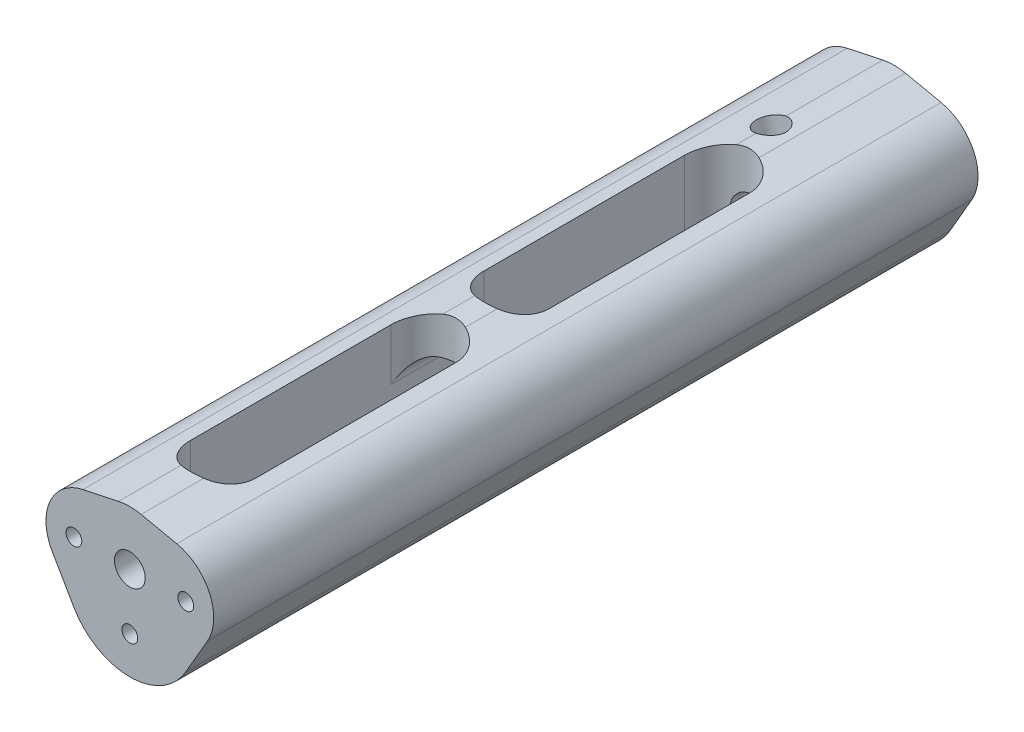
from build123d import *

# Parameters (mm, degrees)
BODYSKE_R       = 0.825
BODYSKE_R_2     = 0.425
BODY_DEPTH      = 41
HOLE_PROFILE_R  = 0.8
CUT1_DEPTH      = 0.825
CUT1_DEPTH_BACK = 42.54816492
CUT2_DEPTH      = 42.548164932
FILLET_2_R      = 1


with BuildPart() as part:
    # BodySke → Body (new body)
    with BuildSketch(Plane.XY):
        with BuildLine():
            Line((4.165063509, -1.25), (3, -3.267949192))
            ThreePointArc((3, -3.267949192), (0, -5), (-3, -3.267949192))
            Line((-3, -3.267949192), (-4.165063509, -1.25))
            ThreePointArc((-4.165063509, -1.25), (-4.283863644, 1.016841608), (-2.519779227, 2.445369002))
            Line((-2.519779227, 2.445369002), (-0.606233769, 2.852105645))
            ThreePointArc((-0.606233769, 2.852105645), (0, 2.915823382), (0.606233769, 2.852105645))
            Line((0.606233769, 2.852105645), (2.519779227, 2.445369002))
            ThreePointArc((2.519779227, 2.445369002), (4.283863644, 1.016841608), (4.165063509, -1.25))
        make_face()
        Circle(BODYSKE_R, mode=Mode.SUBTRACT)
        with Locations((-3, 0)):
            Circle(BODYSKE_R_2, mode=Mode.SUBTRACT)
        with Locations((3, 0)):
            Circle(BODYSKE_R_2, mode=Mode.SUBTRACT)
        with Locations((0, -3)):
            Circle(BODYSKE_R_2, mode=Mode.SUBTRACT)
    extrude(amount=BODY_DEPTH)

    # Hole: sweep along a path in HoleSke
    with BuildLine() as hole_path:  # in the path sketch's own coordinates; laid on its plane below (add() does not lay a ready-made edge on the line's plane)
        Line((6, 2.915823382), (6, 1.704499781))
        add(Edge.make_bspline(
            [(6, 1.704499781), (6, 0.035966381), (4.619948081, 0), (0, 0)],
            knots=[0, 0, 0, 0, 1, 1, 1, 1], degree=3))
    # Hole profile (on start of the path) → Hole (sweep, cut)
    with BuildSketch(Plane(origin=(-0.606233769, 2.852105645, 6), x_dir=(-0.9781476007338055, -0.2079116908177599, 0), z_dir=(0.2079116908177599, -0.9781476007338055, 0))):
        Circle(HOLE_PROFILE_R)
    sweep(path=Plane(origin=(0, 0, 0), x_dir=(0, 0, 1), z_dir=(-0.9781476007338055, -0.2079116908177599, 0)) * hole_path.line, mode=Mode.SUBTRACT)

    # Cut1Ske → Cut1 (cut, two sides: drawn at the far end of the back side and taken through both)
    with BuildSketch(Plane(origin=(0, 0, 0), x_dir=(1, 0, 0), z_dir=(0, 1, 0)).offset(-CUT1_DEPTH_BACK)):
        with BuildLine():
            Line((1.75, -9.5), (1.75, -36))
            ThreePointArc((1.75, -36), (0, -37.75), (-1.75, -36))
            Line((-1.75, -36), (-1.75, -9.5))
            ThreePointArc((-1.75, -9.5), (0, -7.75), (1.75, -9.5))
        make_face()
    extrude(amount=CUT1_DEPTH + CUT1_DEPTH_BACK, mode=Mode.SUBTRACT)

    # Cut2Ske → Cut2 (cut, through all)
    with BuildSketch(Plane(origin=(0, 0, 0), x_dir=(1, 0, 0), z_dir=(0, 1, 0))):
        with BuildLine():
            Line((-1.75, -20.25), (-1.75, -9.5))
            ThreePointArc((-1.75, -9.5), (0, -7.75), (1.75, -9.5))
            Line((1.75, -9.5), (1.75, -20.25))
            ThreePointArc((1.75, -20.25), (0, -22), (-1.75, -20.25))
        make_face()
        with BuildLine():
            Line((1.75, -25.25), (1.75, -36))
            ThreePointArc((1.75, -36), (0, -37.75), (-1.75, -36))
            Line((-1.75, -36), (-1.75, -25.25))
            ThreePointArc((-1.75, -25.25), (0, -23.5), (1.75, -25.25))
        make_face()
    extrude(amount=CUT2_DEPTH, mode=Mode.SUBTRACT)

    # Fillet 2
    fillet_2_edges = [part.edges().sort_by_distance(p)[0] for p in [
        (-1.75, 0.825, 22.75),
        (1.75, 0.825, 22.75),
    ]]
    fillet(fillet_2_edges, radius=FILLET_2_R)


solid = part.part
